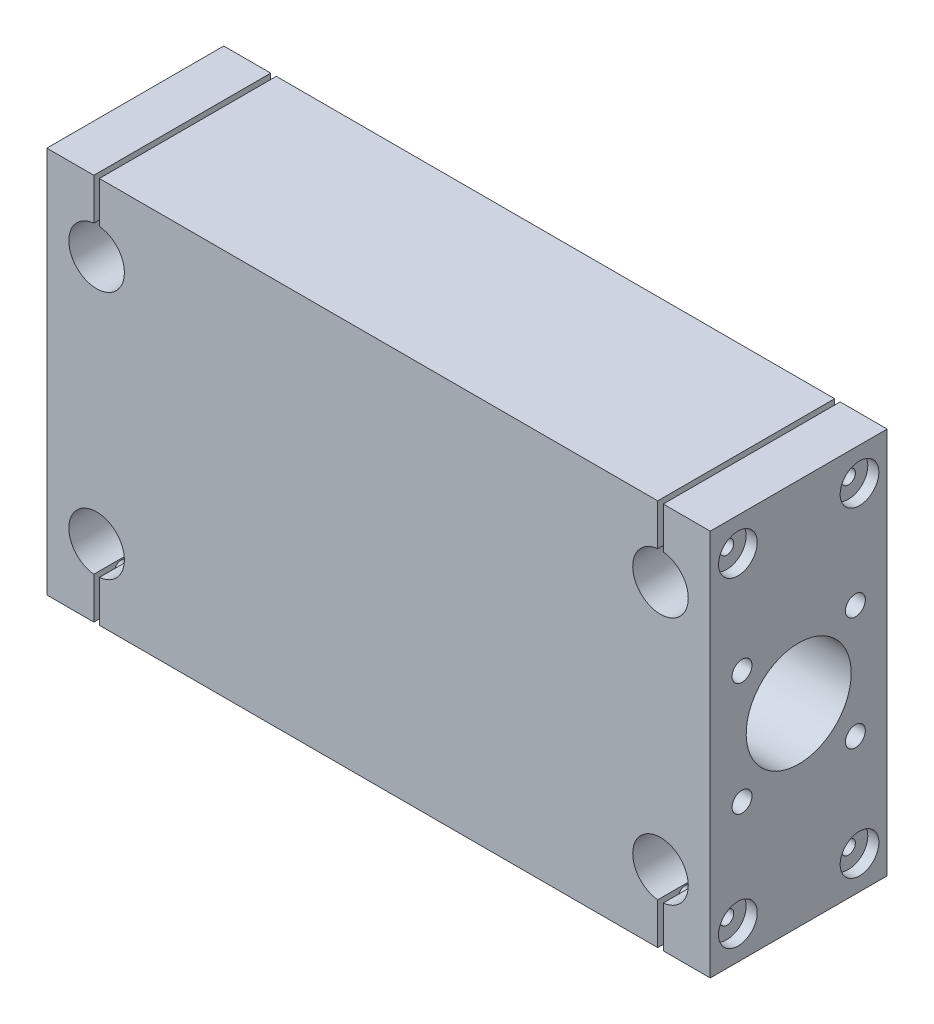
from build123d import *

# Parameters (mm, degrees)
SKETCH1_W                      = 120
SKETCH1_H                      = 70
BOSS_EXTRUDE1_DEPTH            = 32
SKETCH2_R                      = 9.5
LINEAR_BEARING_CUT_1_DEPTH     = 55
Y_AXIS_SHAFTS_CUT_DEPTH        = 143.562267098
LINEAR_BEARING_CUT_2_START     = -55
SKETCH7_R                      = 9.5
LINEAR_BEARING_CUT_2_DEPTH     = 55
SKETCH6_R                      = 6
BETWEEN_BEARINGS_DEPTH         = 101.742245359
SKETCH8_R                      = 3.5
SHAFT_HOLDER_SCREW_CUT_DEPTH   = 4
SKETCH9_R                      = 1.25
SHAFT_HOLDER_SCREW_CUT2_DEPTH  = 20
SHAFT_HOLDER_SCREW_CUT_3_START = -2
SKETCH10_R                     = 3.5
SHAFT_HOLDER_SCREW_CUT_3_DEPTH = 2
SHAFT_HOLDER_SCREW_CUT_4_START = -20
SKETCH11_R                     = 1.25
SHAFT_HOLDER_SCREW_CUT_4_DEPTH = 20
SKETCH12_R                     = 1.8
LINEAR_BEARING_SREW1_DEPTH     = 14
SKETCH13_R                     = 1.85
LINEAR_BEARING_SCREW2_DEPTH    = 14


with BuildPart() as part:
    # Sketch1 → Boss-Extrude1 (new body)
    with BuildSketch(Plane.XY):
        with Locations((-60, -35)):
            Rectangle(SKETCH1_W, SKETCH1_H)
    extrude(amount=BOSS_EXTRUDE1_DEPTH)

    # Sketch2 → Linear_bearing-cut-1 (cut)
    with BuildSketch(Plane.ZY.offset(120)):
        with Locations((16, -35)):
            Circle(SKETCH2_R)
    extrude(amount=-LINEAR_BEARING_CUT_1_DEPTH, mode=Mode.SUBTRACT)

    # Sketch5 → Y-axis-shafts-cut (cut, through all)
    with BuildSketch(Plane.XY.offset(32)):
        with BuildLine():
            Line((-111.5, 0), (-111.5, -7.5))
            ThreePointArc((-111.5, -7.5), (-111, -17.524937811), (-110.5, -7.5))
            Line((-110.5, -7.5), (-110.5, 0))
            Line((-110.5, 0), (-111.5, 0))
        make_face()
        with BuildLine():
            Line((-8.5, 0), (-8.5, -7.5))
            ThreePointArc((-8.5, -7.5), (-9, -17.524937811), (-9.5, -7.5))
            Line((-9.5, -7.5), (-9.5, 0))
            Line((-9.5, 0), (-8.5, 0))
        make_face()
        with BuildLine():
            Line((-111.5, -70), (-111.5, -62.5))
            ThreePointArc((-111.5, -62.5), (-111, -52.475062189), (-110.5, -62.5))
            Line((-110.5, -62.5), (-110.5, -70))
            Line((-110.5, -70), (-111.5, -70))
        make_face()
        with BuildLine():
            Line((-9.5, -70), (-9.5, -62.5))
            ThreePointArc((-9.5, -62.5), (-9, -52.475062189), (-8.5, -62.5))
            Line((-8.5, -62.5), (-8.5, -70))
            Line((-8.5, -70), (-9.5, -70))
        make_face()
    extrude(amount=-Y_AXIS_SHAFTS_CUT_DEPTH, mode=Mode.SUBTRACT)

    # Sketch7 → Linear-bearing-cut-2 (cut)
    with BuildSketch(Plane(origin=(0, 0, 0), x_dir=(0, 0, -1), z_dir=(1, 0, 0)).offset(LINEAR_BEARING_CUT_2_START)):
        with Locations(Location((-16, -35, 0), (0, 0, 180))):
            Circle(SKETCH7_R)
    extrude(amount=LINEAR_BEARING_CUT_2_DEPTH, mode=Mode.SUBTRACT)

    # Sketch6 → between-bearings (cut, through all)
    with BuildSketch(Plane.ZY.offset(65)):
        with Locations((16, -35)):
            Circle(SKETCH6_R)
    extrude(amount=-BETWEEN_BEARINGS_DEPTH, mode=Mode.SUBTRACT)

    # Sketch8 → shaft-holder-screw-cut (cut)
    with BuildSketch(Plane.ZY.offset(120)):
        with Locations((5, -6)):
            Circle(SKETCH8_R)
        with Locations(Location((27, -6, 0), (0, 0, 180))):
            Circle(SKETCH8_R)
        with Locations((27, -64)):
            Circle(SKETCH8_R)
        with Locations(Location((5, -64, 0), (0, 0, 180))):
            Circle(SKETCH8_R)
    extrude(amount=-SHAFT_HOLDER_SCREW_CUT_DEPTH, mode=Mode.SUBTRACT)

    # Sketch9 → shaft-holder-screw-cut2 (cut)
    with BuildSketch(Plane.ZY.offset(116)):
        with Locations((5, -6)):
            Circle(SKETCH9_R)
        with Locations((27, -6)):
            Circle(SKETCH9_R)
        with Locations((5, -64)):
            Circle(SKETCH9_R)
        with Locations((27, -64)):
            Circle(SKETCH9_R)
    extrude(amount=-SHAFT_HOLDER_SCREW_CUT2_DEPTH, mode=Mode.SUBTRACT)

    # Sketch10 → shaft-holder-screw-cut-3 (cut)
    with BuildSketch(Plane(origin=(0, 0, 0), x_dir=(0, 0, -1), z_dir=(1, 0, 0)).offset(SHAFT_HOLDER_SCREW_CUT_3_START)):
        with Locations((-27, -6)):
            Circle(SKETCH10_R)
        with Locations(Location((-5, -6, 0), (0, 0, 180))):
            Circle(SKETCH10_R)
        with Locations((-5, -64)):
            Circle(SKETCH10_R)
        with Locations(Location((-27, -64, 0), (0, 0, 180))):
            Circle(SKETCH10_R)
    extrude(amount=SHAFT_HOLDER_SCREW_CUT_3_DEPTH, mode=Mode.SUBTRACT)

    # Sketch11 → shaft-holder-screw-cut-4 (cut)
    with BuildSketch(Plane(origin=(-2, 0, 0), x_dir=(0, 0, -1), z_dir=(1, 0, 0)).offset(SHAFT_HOLDER_SCREW_CUT_4_START)):
        with Locations(Location((-27, -6, 0), (0, 0, 180))):
            Circle(SKETCH11_R)
        with Locations(Location((-5, -6, 0), (0, 0, 180))):
            Circle(SKETCH11_R)
        with Locations(Location((-5, -64, 0), (0, 0, 180))):
            Circle(SKETCH11_R)
        with Locations(Location((-27, -64, 0), (0, 0, 180))):
            Circle(SKETCH11_R)
    extrude(amount=SHAFT_HOLDER_SCREW_CUT_4_DEPTH, mode=Mode.SUBTRACT)

    # Sketch12 → Linear-bearing-srew1 (cut)
    with BuildSketch(Plane(origin=(0, 0, 0), x_dir=(0, 0, -1), z_dir=(1, 0, 0))):
        with Locations(Location((-5.75, -24.75, 0), (0, 0, 90))):
            Circle(SKETCH12_R)
        with Locations(Location((-26.25, -24.75, 0), (0, 0, 270))):
            Circle(SKETCH12_R)
        with Locations(Location((-5.75, -45.25, 0), (0, 0, 270))):
            Circle(SKETCH12_R)
        with Locations(Location((-26.25, -45.25, 0), (0, 0, 90))):
            Circle(SKETCH12_R)
    extrude(amount=-LINEAR_BEARING_SREW1_DEPTH, mode=Mode.SUBTRACT)

    # Sketch13 → Linear-bearing-screw2 (cut)
    with BuildSketch(Plane.ZY.offset(120)):
        with Locations(Location((27.5, -24.75, 0), (0, 0, 270))):
            Circle(SKETCH13_R)
        with Locations(Location((4.5, -24.75, 0), (0, 0, 90))):
            Circle(SKETCH13_R)
        with Locations(Location((27.5, -45.25, 0), (0, 0, 90))):
            Circle(SKETCH13_R)
        with Locations(Location((4.5, -45.25, 0), (0, 0, 270))):
            Circle(SKETCH13_R)
    extrude(amount=-LINEAR_BEARING_SCREW2_DEPTH, mode=Mode.SUBTRACT)


solid = part.part
